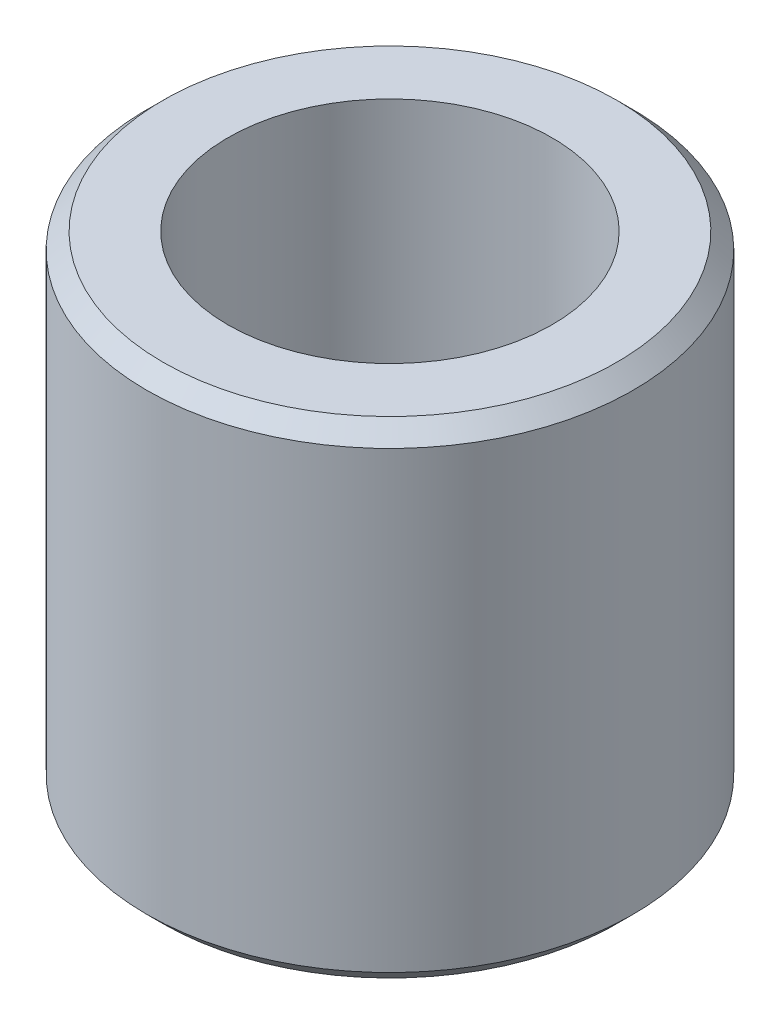
from build123d import *

# Parameters (mm, degrees)
SKETCH2_R           = 15
SKETCH2_R_2         = 10
BOSS_EXTRUDE1_DEPTH = 15
CHAMFER1_SIZE       = 1


with BuildPart() as part:
    # Sketch2 → Boss-Extrude1 (new, symmetric)
    with BuildSketch(Plane(origin=(0, 0, 0), x_dir=(1, 0, 0), z_dir=(0, 1, 0))):
        with Locations(Location((0, 0, 0), (0, 0, 270))):
            Circle(SKETCH2_R)
        with Locations(Location((0, 0, 0), (0, 0, 270))):
            Circle(SKETCH2_R_2, mode=Mode.SUBTRACT)
    extrude(amount=BOSS_EXTRUDE1_DEPTH, both=True)

    # Chamfer1
    chamfer1_edges = [part.edges().sort_by_distance(p)[0] for p in [
        (0, -15, -15),
        (0, 15, -15),
    ]]
    chamfer(chamfer1_edges, length=CHAMFER1_SIZE)


solid = part.part
